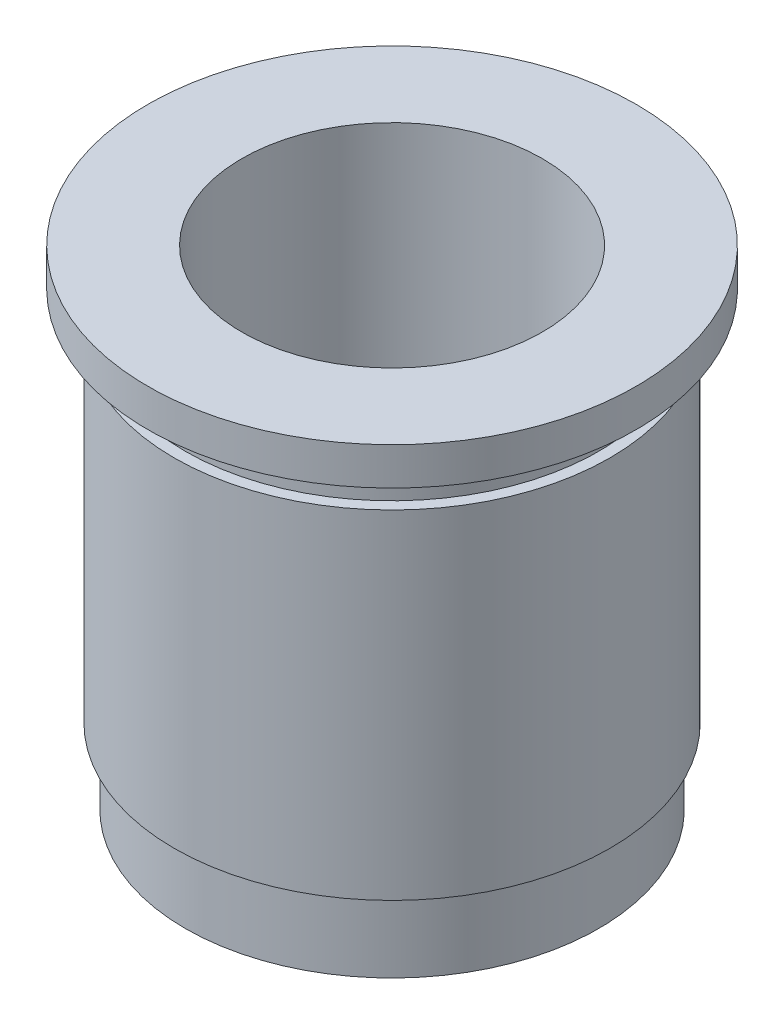
from build123d import *


with BuildPart() as part:
    # ｽｹｯﾁ1 → 回転1 (revolve)
    with BuildSketch(Plane.XY, mode=Mode.PRIVATE) as revolve_1_sk:
        Polygon((2, 6.5), (3.25, 6.5), (3.25, 6), (2.75, 6), (2.75, 5.5), (2.9, 5.5), (2.9, 1), (2.75, 1), (2.75, 0), (2, 0), align=None)
    revolve(revolve_1_sk.sketch.rotate(Axis((0, 0, 0), (0, 1, 0)), 90), axis=Axis((0, 0, 0), (0, 1, 0)))


solid = part.part
